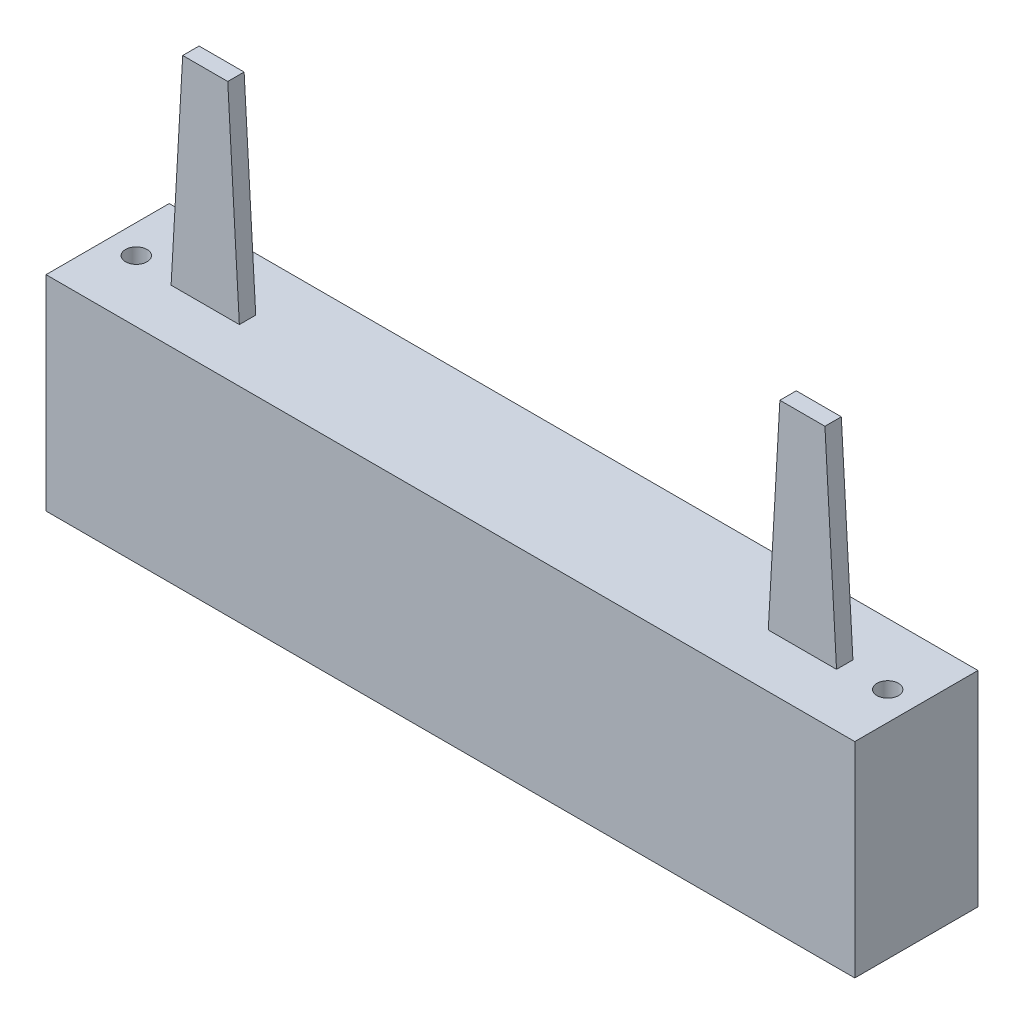
from build123d import *

# Parameters (mm, degrees)
SKETCH1_W                 = 60.198
SKETCH1_H                 = 9.1694
BOSS_EXTRUDE1_DEPTH       = 15.24
SKETCH2_W                 = 5.08
SKETCH2_H                 = 1.2192
BOSS_EXTRUDE2_DEPTH       = 15.24
CUT_EXTRUDE1_REACH        = 69.674
M2X0_4_TAPPED_HOLE1_D     = 1.6
M2X0_4_TAPPED_HOLE1_DEPTH = 2.567311505
M2X0_4_TAPPED_HOLE1_TIP   = 0.480688495


with BuildPart() as part:
    # Sketch1 → Boss-Extrude1 (new body)
    with BuildSketch(Plane(origin=(0, 0, 0), x_dir=(1, 0, 0), z_dir=(0, 1, 0))):
        with Locations((30.099, 4.5847)):
            Rectangle(SKETCH1_W, SKETCH1_H)
    extrude(amount=BOSS_EXTRUDE1_DEPTH)

    # Sketch2 → Boss-Extrude2 (add)
    with BuildSketch(Plane(origin=(0, 15.24, 0), x_dir=(1, 0, 0), z_dir=(0, 1, 0))):
        with Locations((7.874, 4.5847)):
            Rectangle(SKETCH2_W, SKETCH2_H)
        with Locations((52.324, 4.5847)):
            Rectangle(SKETCH2_W, SKETCH2_H)
    extrude(amount=BOSS_EXTRUDE2_DEPTH)

    # Sketch3 → Cut-Extrude1 (cut, up to next)
    with BuildSketch(Plane.XY.offset(-3.9751), mode=Mode.PRIVATE) as cut_extrude1_sk1:
        Polygon((5.334, 15.24), (6.1976, 30.48), (5.334, 30.48), align=None)
    cut_extrude1_tool1 = extrude(cut_extrude1_sk1.sketch, amount=-CUT_EXTRUDE1_REACH, mode=Mode.PRIVATE) & part.part
    # Sketch3 → Cut-Extrude1 (cut, up to next)
    with BuildSketch(Plane.XY.offset(-3.9751), mode=Mode.PRIVATE) as cut_extrude1_sk2:
        Polygon((10.414, 30.48), (9.5504, 30.48), (10.414, 15.24), align=None)
    cut_extrude1_tool2 = extrude(cut_extrude1_sk2.sketch, amount=-CUT_EXTRUDE1_REACH, mode=Mode.PRIVATE) & part.part
    cut_extrude1_1 = cut_extrude1_tool1.solids().sort_by_distance((5.621867, 25.4, -3.9751))[0]
    add(cut_extrude1_1, mode=Mode.SUBTRACT)
    cut_extrude1_2 = cut_extrude1_tool2.solids().sort_by_distance((10.126133, 25.4, -3.9751))[0]
    add(cut_extrude1_2, mode=Mode.SUBTRACT)
    cut_extrude1 = cut_extrude1_1 + cut_extrude1_2  # Cut-Extrude1 as one shape, for the pattern or mirror that repeats it

    # Mirror1: Cut-Extrude1 across plane
    add(cut_extrude1.mirror(Plane(origin=(30.099, 0, 0), x_dir=(0, 0, 1), z_dir=(1, 0, 0))), mode=Mode.SUBTRACT)

    # M2x0.4 Tapped Hole1
    with Locations(Plane(origin=(0, 15.24, 0), x_dir=(1, 0, 0), z_dir=(0, 1, 0))):
        with Locations((2.1336, 4.5847), (58.0644, 4.5847)):
            Hole(M2X0_4_TAPPED_HOLE1_D / 2, depth=M2X0_4_TAPPED_HOLE1_DEPTH)
            with Locations((0, 0, -(M2X0_4_TAPPED_HOLE1_DEPTH + M2X0_4_TAPPED_HOLE1_TIP / 2))):  # 118° drill point
                Cone(0, M2X0_4_TAPPED_HOLE1_D / 2, M2X0_4_TAPPED_HOLE1_TIP, mode=Mode.SUBTRACT)


solid = part.part
